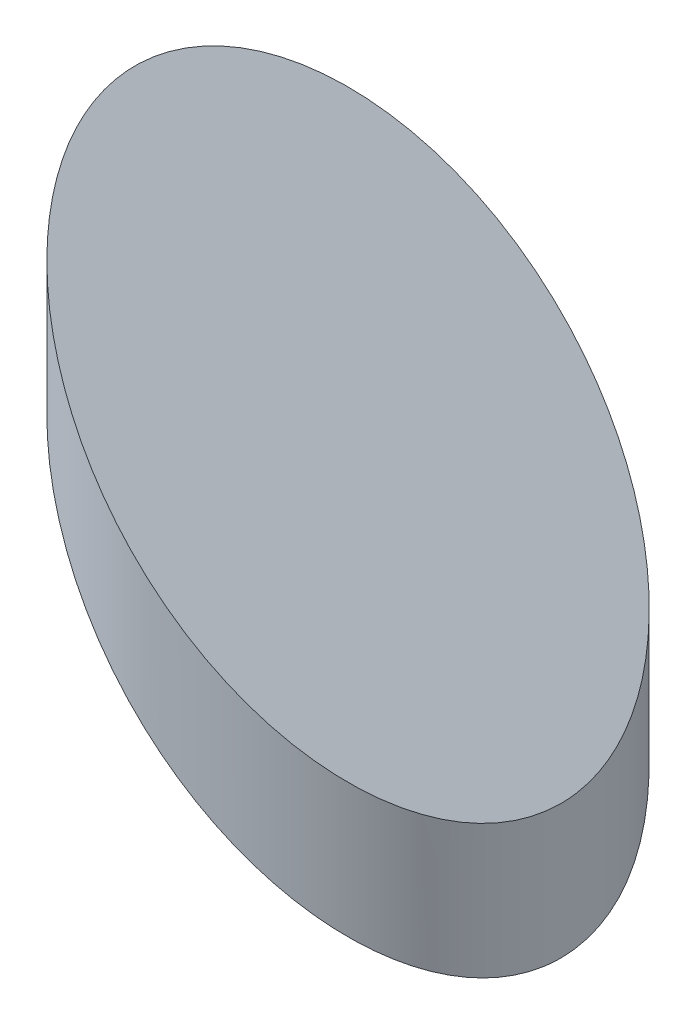
from build123d import *

# Parameters (mm, degrees)
ESQUISSE1_R             = 45
BOSS_EXTRU_1_DEPTH      = 120
ENL_V_MAT_EXTRU_1_DEPTH = 60


with BuildPart() as part:
    # Esquisse1 → Boss.-Extru.1 (new body)
    with BuildSketch(Plane(origin=(0, 0, 0), x_dir=(1, 0, 0), z_dir=(0, 1, 0))):
        with Locations(Location((0, 0, 0), (0, 0, 90))):
            Circle(ESQUISSE1_R)
    extrude(amount=BOSS_EXTRU_1_DEPTH)

    # Esquisse2 → Enlèv. mat.-Extru.1 (cut, symmetric)
    with BuildSketch(Plane.XY):
        Polygon((45, 0), (-45, 90), (-45, 0), align=None)
        Polygon((-45, 118.284271247), (45, 28.284271247), (45, 120), (-45, 120), align=None)
    extrude(amount=ENL_V_MAT_EXTRU_1_DEPTH, both=True, mode=Mode.SUBTRACT)


solid = part.part
